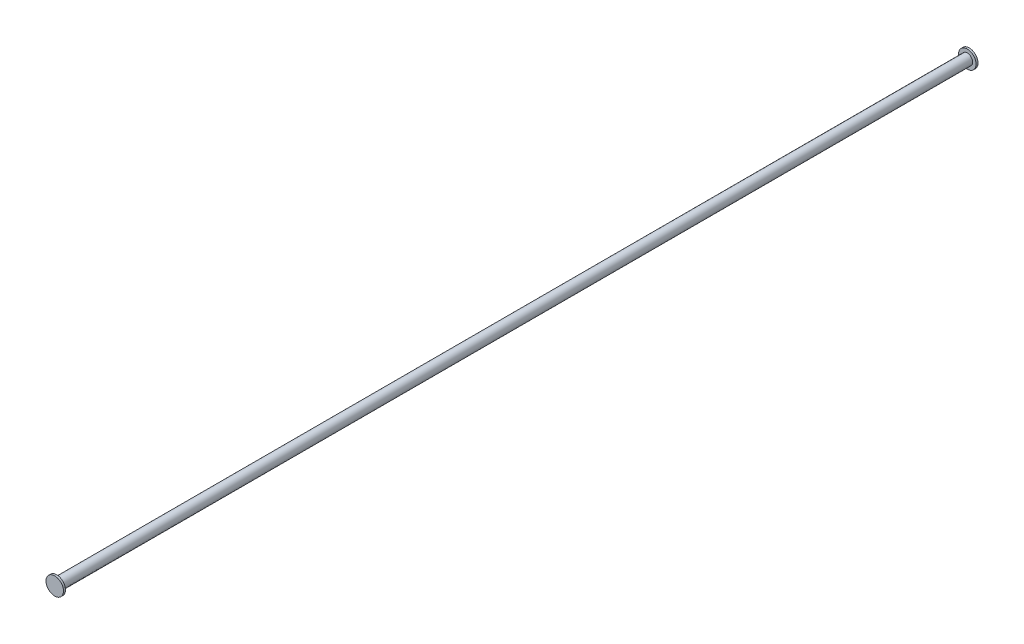
from build123d import *

# Parameters (mm, degrees)
SKETCH1_R           = 1.375
BOSS_EXTRUDE1_DEPTH = 117
SKETCH2_R           = 2.25
BOSS_EXTRUDE2_DEPTH = 0.5


with BuildPart() as part:
    # Sketch1 → Boss-Extrude1 (new, symmetric)
    with BuildSketch(Plane.XY):
        with Locations(Location((0, 0, 0), (0, 0, 180))):
            Circle(SKETCH1_R)
    extrude(amount=BOSS_EXTRUDE1_DEPTH, both=True)

    # Sketch2 → Boss-Extrude2 (add)
    with BuildSketch(Plane.XY.offset(117)):
        Circle(SKETCH2_R)
    boss_extrude2 = extrude(amount=BOSS_EXTRUDE2_DEPTH)

    # Mirror1: Boss-Extrude2 across plane
    add(boss_extrude2.mirror(Plane.XY))


solid = part.part
